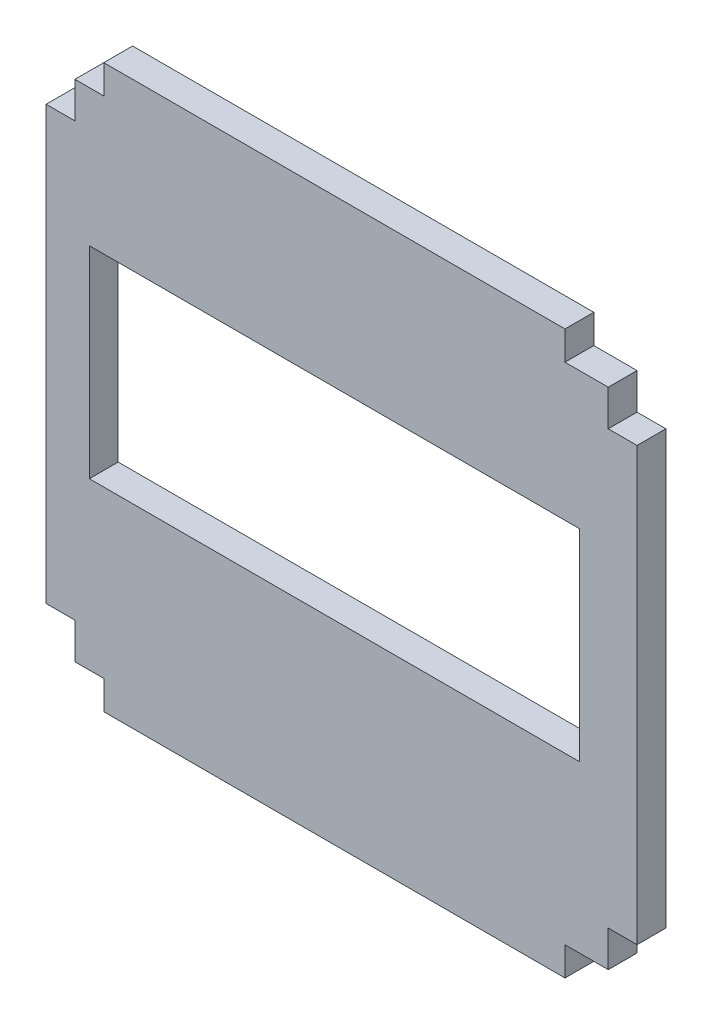
from build123d import *

# Parameters (mm, degrees)
EXTRUDE_1_DEPTH = 2


with BuildPart() as part:
    # 草图1 → 凸台-拉伸1 (new body)
    with BuildSketch(Plane.XY):
        Polygon((0, -35), (2, -35), (2, -37), (34, -37), (34, -35), (37, -35), (37, -32.5), (39, -32.5), (39, -2.5), (37, -2.5), (37, 0), (34, 0), (34, 2), (2, 2), (2, 0), (0, 0), (0, -2.5), (-2, -2.5), (-2, -32.5), (0, -32.5), align=None)
        Polygon((18, -23.5), (2.5, -23.5), (1, -23.5), (1, -11.5), (1, -9.5), (35, -9.5), (35, -11.5), (35, -23.5), (33.5, -23.5), align=None, mode=Mode.SUBTRACT)
    extrude(amount=EXTRUDE_1_DEPTH)


solid = part.part
